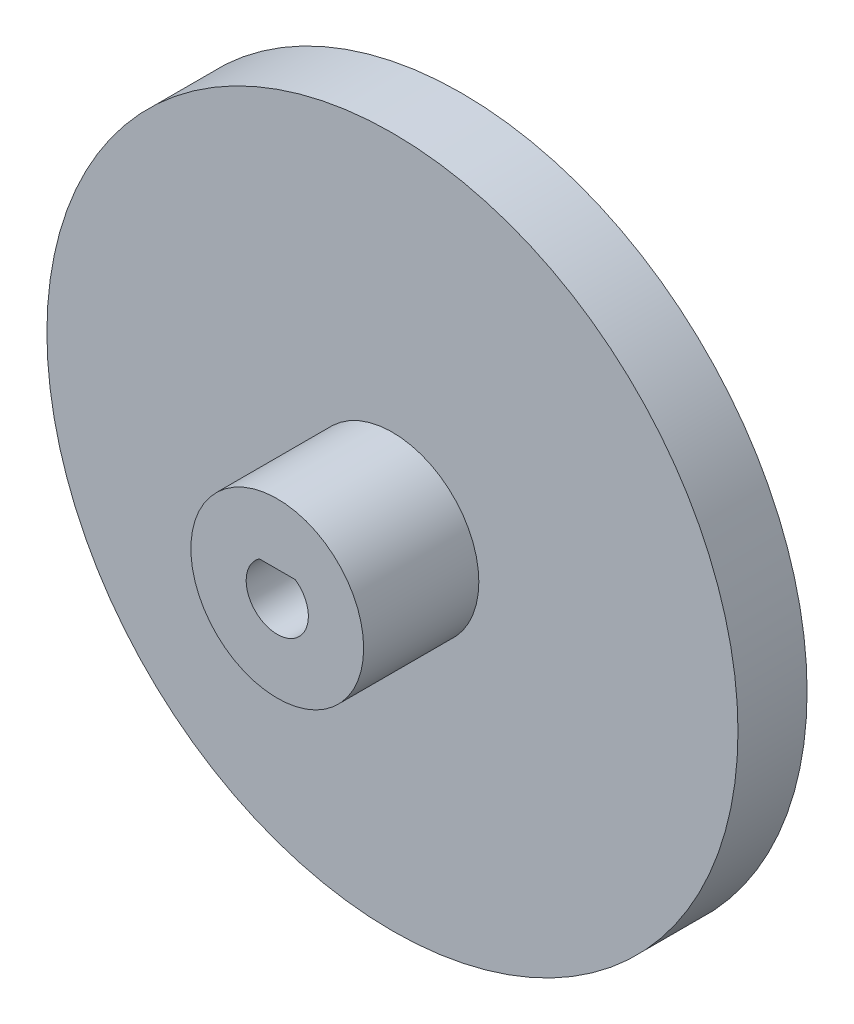
from build123d import *

# Parameters (mm, degrees)
SKETCH2_R           = 7.5
BOSS_EXTRUDE1_DEPTH = 10
BOSS_EXTRUDE3_START = 3
SKETCH4_R           = 30
SKETCH4_R_2         = 4.25
BOSS_EXTRUDE3_DEPTH = 3
BOSS_EXTRUDE4_START = 3
SKETCH5_R           = 30
BOSS_EXTRUDE4_DEPTH = 3
BOSS_EXTRUDE5_START = 10
SKETCH6_R           = 7.5
BOSS_EXTRUDE5_DEPTH = 10


with BuildPart() as part:
    # Sketch2 → Boss-Extrude1 (new body)
    with BuildSketch(Plane.XY):
        Circle(SKETCH2_R)
        with BuildLine():
            ThreePointArc((-1.565247584, 2.2), (0, -2.7), (1.565247584, 2.2))
            Line((1.565247584, 2.2), (-1.565247584, 2.2))
        make_face(mode=Mode.SUBTRACT)
    extrude(amount=-BOSS_EXTRUDE1_DEPTH)

    # Sketch4 → Boss-Extrude3 (add)
    with BuildSketch(Plane.XY.offset(BOSS_EXTRUDE3_START)):
        Circle(SKETCH4_R)
        with Locations((-16.970562748, -16.970562748)):
            Circle(SKETCH4_R_2, mode=Mode.SUBTRACT)
        with Locations((-24, 0)):
            Circle(SKETCH4_R_2, mode=Mode.SUBTRACT)
        with Locations((0, -24)):
            Circle(SKETCH4_R_2, mode=Mode.SUBTRACT)
        with Locations((16.970562748, -16.970562748)):
            Circle(SKETCH4_R_2, mode=Mode.SUBTRACT)
        with Locations((-16.970562748, 16.970562748)):
            Circle(SKETCH4_R_2, mode=Mode.SUBTRACT)
        with Locations((24, 0)):
            Circle(SKETCH4_R_2, mode=Mode.SUBTRACT)
        with Locations((0, 24)):
            Circle(SKETCH4_R_2, mode=Mode.SUBTRACT)
        with Locations((16.970562748, 16.970562748)):
            Circle(SKETCH4_R_2, mode=Mode.SUBTRACT)
        with BuildLine():
            ThreePointArc((1.565247584, 2.2), (0, -2.7), (-1.565247584, 2.2))
            Line((-1.565247584, 2.2), (1.565247584, 2.2))
        make_face(mode=Mode.SUBTRACT)
    extrude(amount=-BOSS_EXTRUDE3_DEPTH)

    # Sketch5 → Boss-Extrude4 (add)
    with BuildSketch(Plane.XY.offset(3).offset(BOSS_EXTRUDE4_START)):
        Circle(SKETCH5_R)
    extrude(amount=-BOSS_EXTRUDE4_DEPTH)

    # Sketch6 → Boss-Extrude5 (add)
    with BuildSketch(Plane.XY.offset(6).offset(BOSS_EXTRUDE5_START)):
        Circle(SKETCH6_R)
        with BuildLine():
            Line((1.565247584, 2.2), (-1.565247584, 2.2))
            ThreePointArc((-1.565247584, 2.2), (0, -2.7), (1.565247584, 2.2))
        make_face(mode=Mode.SUBTRACT)
    extrude(amount=-BOSS_EXTRUDE5_DEPTH)


solid = part.part
